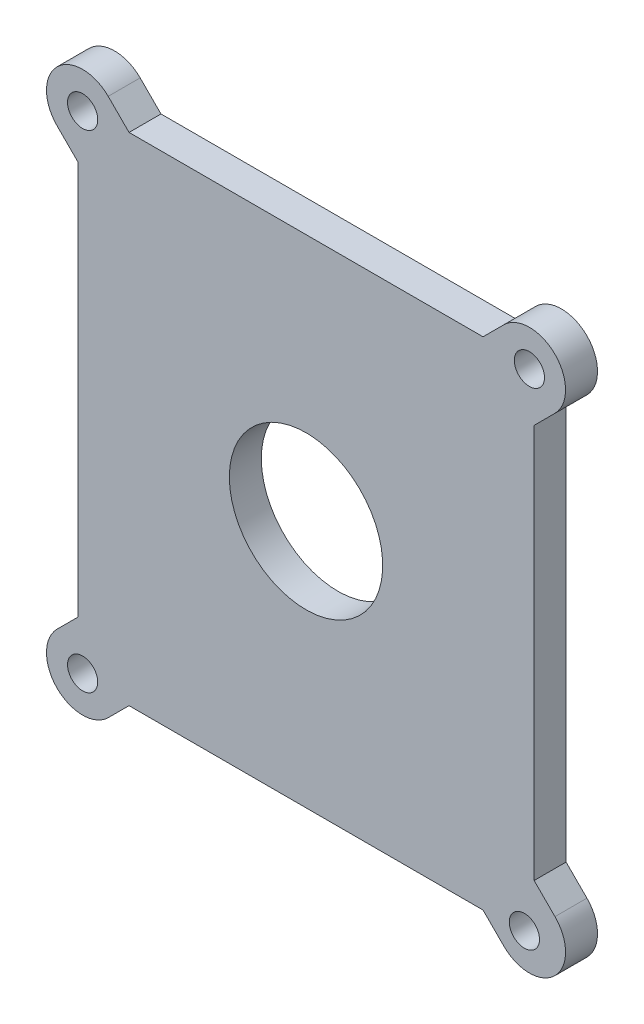
from build123d import *

# Parameters (mm, degrees)
SKETCH1_R               = 11.43
BOSS_EXTRUDE1_DEPTH     = 4.7625
MIRROR2_COPY_1_SKETCH_R = 11.43
MIRROR2_COPY_1_DEPTH    = 4.7625
M4_CLEARANCE_HOLE2_D    = 4.5


with BuildPart() as part:
    # Sketch1 → Boss-Extrude1 (new body)
    with BuildSketch(Plane.XY):
        with BuildLine():
            Line((33.9979, -29.3751), (33.9979, 36.9951))
            Line((33.9979, 36.9951), (-33.9979, 36.9951))
            Line((-33.9979, 36.9951), (-33.9979, -36.9951))
            Line((-33.9979, -36.9951), (26.3779, -36.9951))
            Line((26.3779, -36.9951), (29.48387433, -40.10107433))
            ThreePointArc((29.48387433, -40.10107433), (37.10387433, -40.10107433), (37.10387433, -32.48107433))
            Line((37.10387433, -32.48107433), (33.9979, -29.3751))
        make_face()
        with Locations(Location((0, 0, 0), (0, 0, 180))):
            Circle(SKETCH1_R, mode=Mode.SUBTRACT)
        Polygon((33.926365892, -36.9951), (33.9979, -36.923565892), (33.9979, -36.9951), align=None, mode=Mode.SUBTRACT)
    boss_extrude1 = extrude(amount=BOSS_EXTRUDE1_DEPTH)

    # Mirror1: Boss-Extrude1 across plane
    add(boss_extrude1.mirror(Plane.ZX))

    # Mirror2: Boss-Extrude1 across plane
    add(boss_extrude1.mirror(Plane(origin=(0, 0, 0), x_dir=(0, 0, 1), z_dir=(1, 0, 0))))

    # Mirror2 copy 1 sketch → Mirror2 copy 1 (add)
    with BuildSketch(Plane(origin=(0, 0, 0), x_dir=(-1, 0, 0), z_dir=(0, 0, 1))):
        with BuildLine():
            Line((33.9979, -29.3751), (33.9979, 36.9951))
            Line((33.9979, 36.9951), (-33.9979, 36.9951))
            Line((-33.9979, 36.9951), (-33.9979, -36.9951))
            Line((-33.9979, -36.9951), (26.3779, -36.9951))
            Line((26.3779, -36.9951), (29.48387433, -40.10107433))
            ThreePointArc((29.48387433, -40.10107433), (37.10387433, -40.10107433), (37.10387433, -32.48107433))
            Line((37.10387433, -32.48107433), (33.9979, -29.3751))
        make_face()
        with Locations(Location((0, 0, 0), (0, 0, 180))):
            Circle(MIRROR2_COPY_1_SKETCH_R, mode=Mode.SUBTRACT)
        Polygon((33.926365892, -36.9951), (33.9979, -36.923565892), (33.9979, -36.9951), align=None, mode=Mode.SUBTRACT)
    extrude(amount=MIRROR2_COPY_1_DEPTH)

    # M4 Clearance Hole2 (through all)
    with Locations(Plane.XY.offset(4.7625)):
        with Locations((-33.29387433, 36.29107433), (33.29387433, 36.29107433), (32.547164682, -36.586652732), (-33.29387433, -36.29107433)):
            Hole(M4_CLEARANCE_HOLE2_D / 2)


solid = part.part
